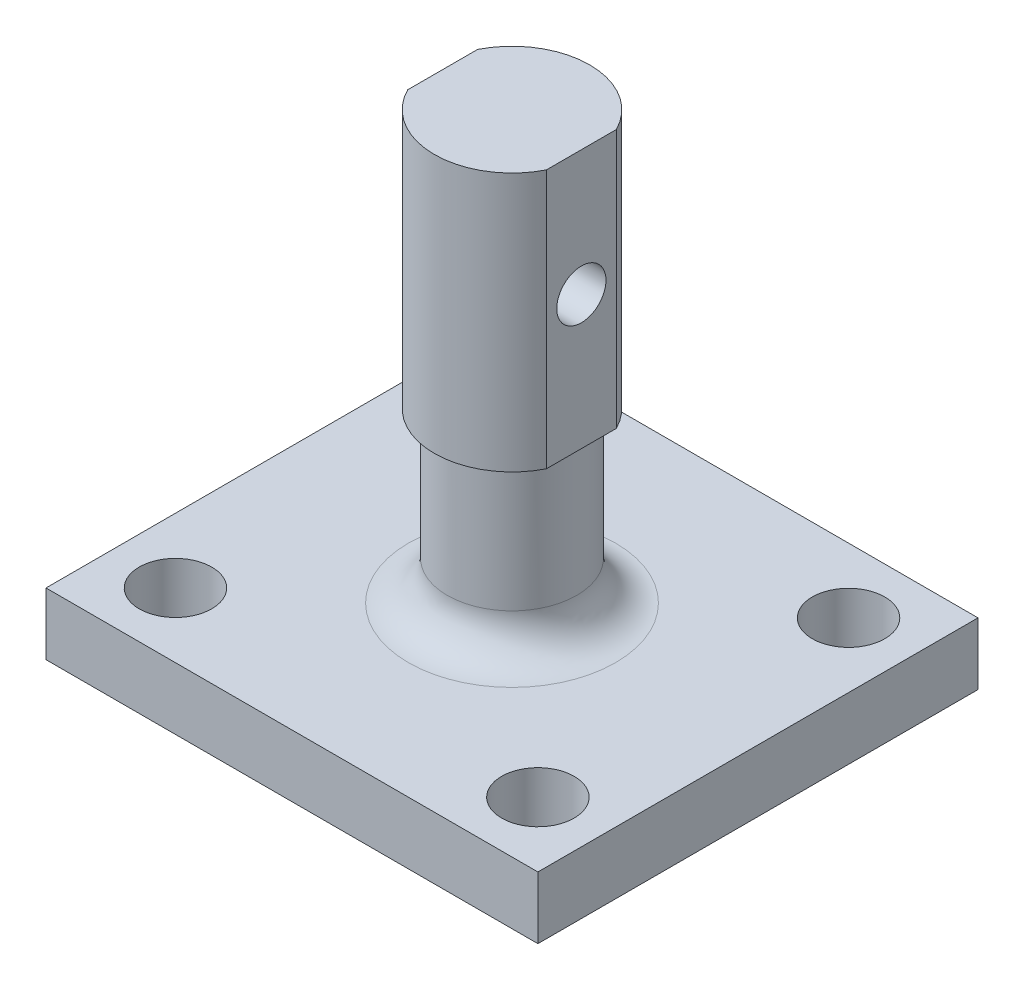
from build123d import *

# Parameters (mm, degrees)
SKETCH1_W               = 9.5
SKETCH1_H               = 8.5
BOSS_EXTRUDE1_DEPTH     = 1.2
CUT_EXTRUDE1_DEPTH      = 7.485753619
CUT_EXTRUDE1_DEPTH_BACK = 7.485753619
SKETCH2_R               = 0.7
SKETCH5_R               = 1.25
BOSS_EXTRUDE2_DEPTH     = 3.25
FILLET1_R               = 0.75
SKETCH37_R              = 1.5
BOSS_EXTRUDE3_DEPTH     = 5
CUT_EXTRUDE3_START      = -6
CUT_EXTRUDE3_DEPTH      = 6
SKETCH41_R              = 0.475
CUT_EXTRUDE4_DEPTH      = 10


with BuildPart() as part:
    # Sketch1 → Boss-Extrude1 (new body)
    with BuildSketch(Plane(origin=(0, 0, 0), x_dir=(1, 0, 0), z_dir=(0, 1, 0))):
        Rectangle(SKETCH1_W, SKETCH1_H)
    extrude(amount=BOSS_EXTRUDE1_DEPTH)

    # Sketch2 → Cut-Extrude1 (cut, two sides: drawn at the far end of the back side and taken through both)
    with BuildSketch(Plane(origin=(0, 1.2, 0), x_dir=(1, 0, 0), z_dir=(0, 1, 0)).offset(-CUT_EXTRUDE1_DEPTH_BACK)):
        with Locations(Location((-3.5, -3, 0), (0, 0, 270))):
            Circle(SKETCH2_R)
        with Locations(Location((-3.5, 3, 0), (0, 0, 270))):
            Circle(SKETCH2_R)
        with Locations(Location((3.5, 3, 0), (0, 0, 270))):
            Circle(SKETCH2_R)
        with Locations(Location((3.5, -3, 0), (0, 0, 270))):
            Circle(SKETCH2_R)
    extrude(amount=CUT_EXTRUDE1_DEPTH + CUT_EXTRUDE1_DEPTH_BACK, mode=Mode.SUBTRACT)

    # Sketch5 → Boss-Extrude2 (add)
    with BuildSketch(Plane(origin=(0, 1.2, 0), x_dir=(1, 0, 0), z_dir=(0, 1, 0))):
        with Locations(Location((0, 0, 0), (0, 0, 90))):
            Circle(SKETCH5_R)
    extrude(amount=BOSS_EXTRUDE2_DEPTH)

    # Fillet1
    fillet1_edges = [part.edges().sort_by_distance(p)[0] for p in [
        (0, 1.2, 1.25),
    ]]
    fillet(fillet1_edges, radius=FILLET1_R)

    # Sketch37 → Boss-Extrude3 (add)
    with BuildSketch(Plane(origin=(0, 4.45, 0), x_dir=(1, 0, 0), z_dir=(0, 1, 0))):
        with Locations(Location((0, 0, 0), (0, 0, 270))):
            Circle(SKETCH37_R)
    extrude(amount=BOSS_EXTRUDE3_DEPTH)

    # Sketch40 → Cut-Extrude3 (cut)
    with BuildSketch(Plane(origin=(0, 9.45, 0), x_dir=(1, 0, 0), z_dir=(0, 1, 0)).offset(CUT_EXTRUDE3_START)):
        with BuildLine():
            Line((-1.339542832, 0.675), (-1.339542832, -0.675))
            ThreePointArc((-1.339542832, -0.675), (-1.5, 0), (-1.339542832, 0.675))
        make_face()
        with BuildLine():
            Line((1.339542832, 0.675), (1.339542832, -0.675))
            ThreePointArc((1.339542832, -0.675), (1.5, 0), (1.339542832, 0.675))
        make_face()
    extrude(amount=CUT_EXTRUDE3_DEPTH, mode=Mode.SUBTRACT)

    # Sketch41 → Cut-Extrude4 (cut)
    with BuildSketch(Plane(origin=(1.339542832, 0, 0), x_dir=(0, 0, -1), z_dir=(1, 0, 0))):
        with Locations((0, 7.03)):
            Circle(SKETCH41_R)
    extrude(amount=-CUT_EXTRUDE4_DEPTH, mode=Mode.SUBTRACT)


solid = part.part
